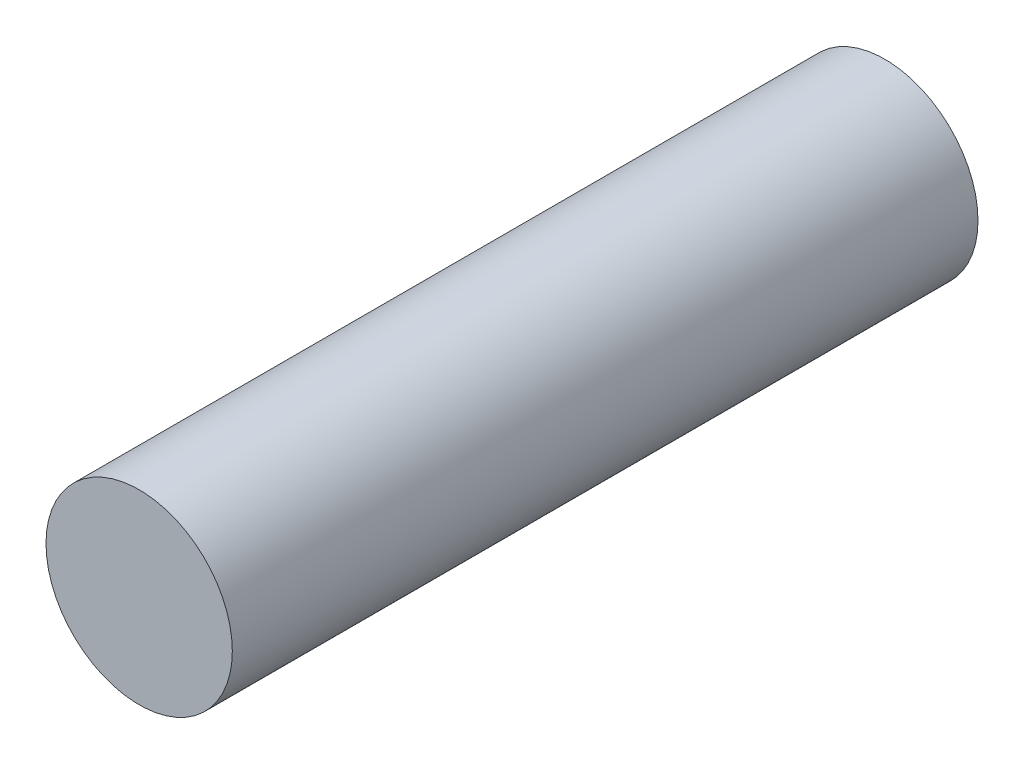
from build123d import *

# Parameters (mm, degrees)
SKETCH1_R           = 4.76
BOSS_EXTRUDE1_DEPTH = 38.1


with BuildPart() as part:
    # Sketch1 → Boss-Extrude1 (new body)
    with BuildSketch(Plane.XY):
        with Locations(Location((0, 0, 0), (0, 0, 180))):
            Circle(SKETCH1_R)
    extrude(amount=BOSS_EXTRUDE1_DEPTH)


solid = part.part
